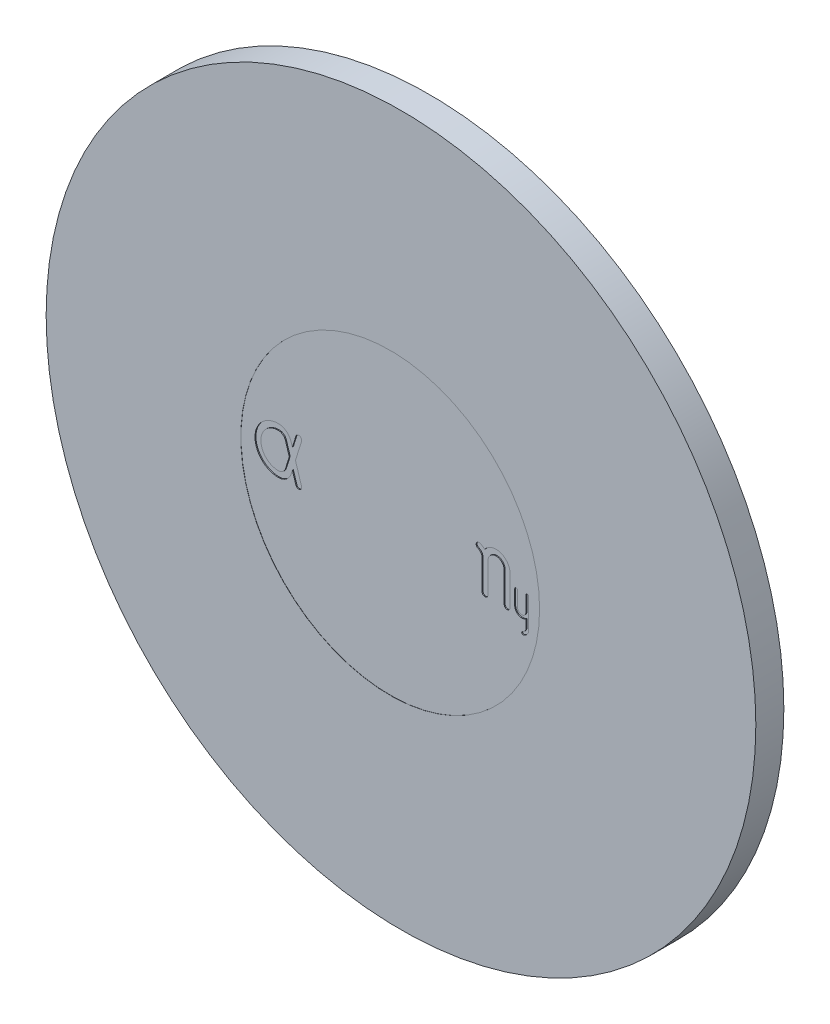
from build123d import *

# Parameters (mm, degrees)
SKETCH_1_R          = 38
EXTRUDE_1_DEPTH     = 3
SKETCH_2_R          = 16
CUT_EXTRUDE_2_DEPTH = 0.02
CUT_EXTRUDE_3_DEPTH = 0.1


with BuildPart() as part:
    # Эскиз1 → Вытянуть1 (new body)
    with BuildSketch(Plane.XY):
        with Locations((1.155432358, 0.834536784)):
            Circle(SKETCH_1_R)
    extrude(amount=EXTRUDE_1_DEPTH)

    # Эскиз2 → Вытянуть2 (cut)
    with BuildSketch(Plane.XY.offset(3)):
        Circle(SKETCH_2_R)
    extrude(amount=-CUT_EXTRUDE_2_DEPTH, mode=Mode.SUBTRACT)

    # Эскиз3 → Вытянуть3 (cut)
    # profile 1 of 3: a face of its own
    with BuildSketch(Plane.XY.offset(2.98)):
        with BuildLine():
            ThreePointArc((9.393894737, 2.302891329), (9.203408238, 2.705588354), (9.606105263, 2.896074853))
            ThreePointArc((9.606105263, 2.896074853), (9.870539579, 2.764896264), (10.097373549, 2.576005609))
            ThreePointArc((10.097373549, 2.576005609), (11.775195787, 3.127662368), (12.815, 1.7))
            Line((12.815, 1.7), (12.815, -1.485))
            ThreePointArc((12.815, -1.485), (12.5, -1.8), (12.185, -1.485))
            Line((12.185, -1.485), (12.185, 1.7))
            ThreePointArc((12.185, 1.7), (11.315, 2.57), (10.445, 1.7))
            Line((10.445, 1.7), (10.445, -1.485))
            ThreePointArc((10.445, -1.485), (10.13, -1.8), (9.815, -1.485))
            Line((9.815, -1.485), (9.815, 1.7))
            Line((9.815, 1.7), (9.815, 1.705))
            ThreePointArc((9.815, 1.705), (9.699157085, 2.070651365), (9.393894737, 2.302891329))
        make_face()
    # profile 2 of 3: a face of its own
    with BuildSketch(Plane.XY.offset(2.98)):
        with BuildLine():
            Line((-10.497591493, 1.756383955), (-10.635054332, 2.196407461))
            ThreePointArc((-10.635054332, 2.196407461), (-11.152905752, 2.922098665), (-12, 3.2))
            ThreePointArc((-12, 3.2), (-13.767766953, 2.467766953), (-14.5, 0.7))
            ThreePointArc((-14.5, 0.7), (-13.767766953, -1.067766953), (-12, -1.8))
            ThreePointArc((-12, -1.8), (-11.152905752, -1.522098665), (-10.635054332, -0.796407461))
            Line((-10.635054332, -0.796407461), (-10.497591493, -0.356383955))
            Line((-10.497591493, -0.356383955), (-10.11566985, -1.578928916))
            ThreePointArc((-10.11566985, -1.578928916), (-9.721071084, -1.78566985), (-9.51433015, -1.391071084))
            Line((-9.51433015, -1.391071084), (-10.167578358, 0.7))
            Line((-10.167578358, 0.7), (-9.51433015, 2.791071084))
            ThreePointArc((-9.51433015, 2.791071084), (-9.721071084, 3.18566985), (-10.11566985, 2.978928916))
            Line((-10.11566985, 2.978928916), (-10.497591493, 1.756383955))
        make_face()
        with BuildLine():
            Line((-10.827604629, 0.7), (-11.237145368, -0.610954683))
            ThreePointArc((-11.237145368, -0.610954683), (-11.527689249, -1.01570067), (-12.001425757, -1.170001613))
            ThreePointArc((-12.001425757, -1.170001613), (-13.32305175, -0.621529891), (-13.87000042, 0.700727136))
            ThreePointArc((-13.87000042, 0.700727136), (-13.322537782, 2.02204425), (-12.001425757, 2.570001613))
            ThreePointArc((-12.001425757, 2.570001613), (-11.527689249, 2.41570067), (-11.237145368, 2.010954683))
            Line((-11.237145368, 2.010954683), (-10.827604629, 0.7))
        make_face(mode=Mode.SUBTRACT)
    # profile 3 of 3: a face of its own
    with BuildSketch(Plane.XY.offset(2.98)):
        with BuildLine():
            ThreePointArc((14.515, -2.55), (14.420756237, -2.825567596), (14.1775, -2.985710626))
            ThreePointArc((14.1775, -2.985710626), (14.069763125, -3.168447502), (14.2525, -3.276184377))
            ThreePointArc((14.2525, -3.276184377), (14.657927061, -3.009279327), (14.815, -2.55))
            Line((14.815, -2.55), (14.815, 0.55))
            ThreePointArc((14.815, 0.55), (14.665, 0.7), (14.515, 0.55))
            Line((14.515, 0.55), (14.515, -1.05))
            ThreePointArc((14.515, -1.05), (14.065, -1.5), (13.615, -1.05))
            Line((13.615, -1.05), (13.615, 0.55))
            ThreePointArc((13.615, 0.55), (13.465, 0.7), (13.315, 0.55))
            Line((13.315, 0.55), (13.315, -1.05))
            ThreePointArc((13.315, -1.05), (13.729589803, -1.720820393), (14.515, -1.65))
            Line((14.515, -1.65), (14.515, -2.55))
        make_face()
    extrude(amount=-CUT_EXTRUDE_3_DEPTH, mode=Mode.SUBTRACT)


solid = part.part
